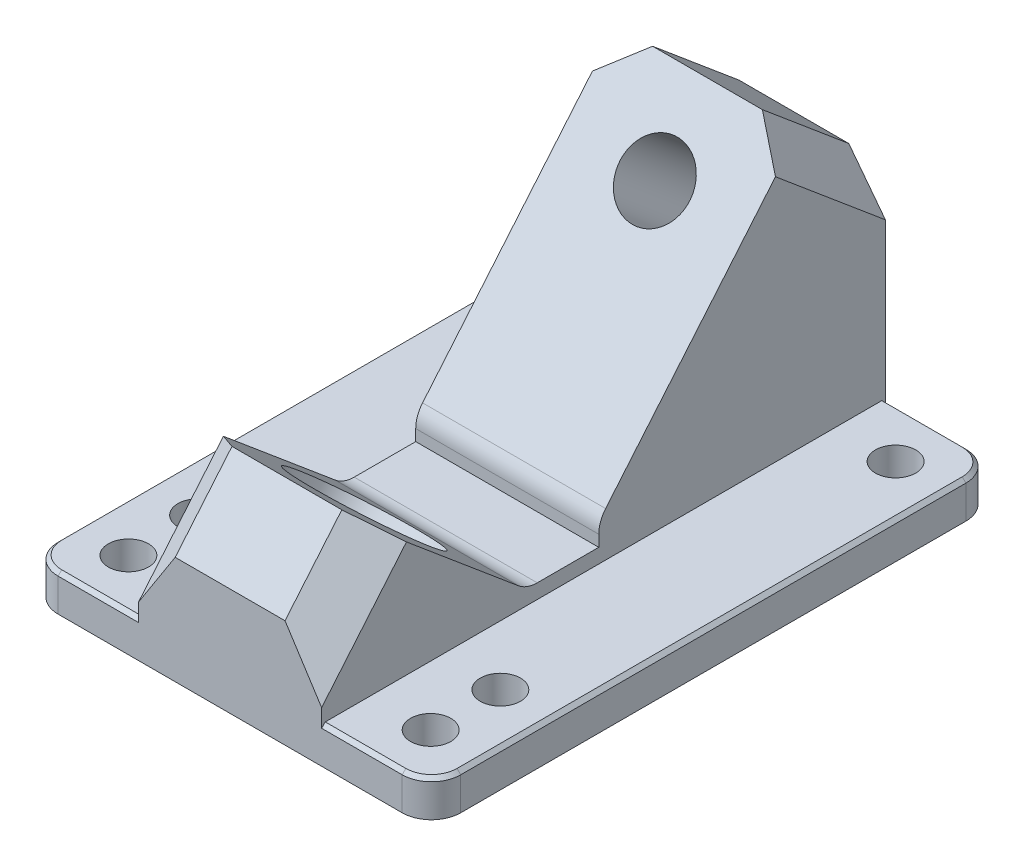
from build123d import *
from OCP.BRepFilletAPI import BRepFilletAPI_MakeChamfer

# Parameters (mm, degrees)
SKETCH1_W                  = 55
SKETCH1_H                  = 77
BOSS_EXTRUDE1_DEPTH        = 45
CUT_EXTRUDE1_DEPTH         = 66.295482233
CUT_EXTRUDE1_DEPTH_BACK    = 66.295482233
SKETCH2_W                  = 15
SKETCH2_H                  = 45
CUT_EXTRUDE2_DEPTH         = 61.526853545
CUT_EXTRUDE2_DEPTH_BACK    = 61.526853545
SKETCH9_R                  = 4.7625
CUT_EXTRUDE5_DEPTH         = 60.605373357
CUT_EXTRUDE4_DEPTH         = 7.5
CUT_EXTRUDE4_DEPTH_BACK    = 7.5
CHAMFER1_SIZE              = 5
FILLET1_R                  = 4
F_12_0MM_DOWEL_HOLE2_D     = 18
F_12_0MM_DOWEL_HOLE2_DEPTH = 12
F_12_0MM_DOWEL_HOLE2_TIP   = 5.407745571
CUT_EXTRUDE6_DEPTH         = 59.947948642
CUT_EXTRUDE6_DEPTH_BACK    = 59.947948642
SKETCH16_W                 = 77
SKETCH16_H                 = 0.28
SKETCH17_W                 = 15
SKETCH17_H                 = 77
BOSS_EXTRUDE2_DEPTH        = 5
SKETCH18_R                 = 2.75
CUT_EXTRUDE8_DEPTH         = 10
FILLET2_R                  = 4
CHAMFER2_SIZE              = 0.5
CHAMFER2_SIZE2             = 4.056570221


with BuildPart() as part:
    # Sketch1 → Boss-Extrude1 (new body)
    with BuildSketch(Plane(origin=(0, 0, 0), x_dir=(1, 0, 0), z_dir=(0, 1, 0))):
        Rectangle(SKETCH1_W, SKETCH1_H)
    extrude(amount=BOSS_EXTRUDE1_DEPTH)

    # Sketch2 → Cut-Extrude1 (cut, two sides: drawn at the far end of the back side and taken through both)
    with BuildSketch(Plane.XY.offset(-CUT_EXTRUDE1_DEPTH_BACK)):
        with Locations((-20, 22.5)):
            Rectangle(SKETCH2_W, SKETCH2_H)
        with Locations((20, 22.5)):
            Rectangle(SKETCH2_W, SKETCH2_H)
    extrude(amount=CUT_EXTRUDE1_DEPTH + CUT_EXTRUDE1_DEPTH_BACK, mode=Mode.SUBTRACT)

    # Sketch3 → Cut-Extrude2 (cut, two sides: drawn at the far end of the back side and taken through both)
    with BuildSketch(Plane(origin=(0, 0, 0), x_dir=(0, 0, -1), z_dir=(1, 0, 0)).offset(-CUT_EXTRUDE2_DEPTH_BACK)):
        Polygon((-38.5, 15), (-31.51055999, 23.329690242), (-30.745642734, 24.241283129), (-10.508137558, 7.26), (-0.650260841, 7.26), (-0.650260841, 10.26), (26.698327812, 42.85277878), (38.5, 32.95), (38.5, 45), (24.14, 45), (-38.5, 45), align=None)
    extrude(amount=CUT_EXTRUDE2_DEPTH + CUT_EXTRUDE2_DEPTH_BACK, mode=Mode.SUBTRACT)

    # Sketch9 → Cut-Extrude5 (cut, through all)
    with BuildSketch(Plane(origin=(0, 4.559375807, 5.433652498), x_dir=(1, 0, 0), z_dir=(0, 0.6427876096865435, 0.7660444431189747))):
        with Locations(Location((0, 38.806982034, 0), (0, 0, 270))):
            Circle(SKETCH9_R)
    extrude(amount=-CUT_EXTRUDE5_DEPTH, mode=Mode.SUBTRACT)

    # Sketch5 → Cut-Extrude4 (cut, two sides: drawn at the far end of the back side and taken through both)
    with BuildSketch(Plane(origin=(0, 0, 0), x_dir=(0, 0, -1), z_dir=(1, 0, 0)).offset(-CUT_EXTRUDE4_DEPTH_BACK)):
        Polygon((38.5, 0), (38.5, 30), (13.327011065, 0), align=None)
    extrude(amount=CUT_EXTRUDE4_DEPTH + CUT_EXTRUDE4_DEPTH_BACK, mode=Mode.SUBTRACT)

    # Chamfer1
    chamfer1_edges = [part.edges().sort_by_distance(p)[0] for p in [
        (-12.5, 19.620641565, 34.622821367),
        (-12.5, 37.90138939, -32.599163906),
        (12.5, 19.620641565, 34.622821367),
        (12.5, 37.90138939, -32.599163906),
    ]]
    chamfer(chamfer1_edges, length=CHAMFER1_SIZE)

    # Fillet1
    fillet1_edges = [part.edges().sort_by_distance(p)[0] for p in [
        (0, 10.26, 0.650260841),
        (0, 7.26, 10.508137558),
    ]]
    fillet(fillet1_edges, radius=FILLET1_R)

    # Ø12.0mm Dowel Hole2
    with Locations(Plane(origin=(0, -0.913904784, 0.766857167), x_dir=(1, 0, 0), z_dir=(0, 0.7660444431189749, -0.6427876096865432))):
        with Locations((0, -25.333129579)):
            Hole(F_12_0MM_DOWEL_HOLE2_D / 2, depth=F_12_0MM_DOWEL_HOLE2_DEPTH)
            with Locations((0, 0, -(F_12_0MM_DOWEL_HOLE2_DEPTH + F_12_0MM_DOWEL_HOLE2_TIP / 2))):  # 118° drill point
                Cone(0, F_12_0MM_DOWEL_HOLE2_D / 2, F_12_0MM_DOWEL_HOLE2_TIP, mode=Mode.SUBTRACT)

    # Sketch16 → Cut-Extrude6 (cut, two sides: drawn at the far end of the back side and taken through both)
    with BuildSketch(Plane(origin=(0, 0, 0), x_dir=(0, 0, -1), z_dir=(1, 0, 0)).offset(-CUT_EXTRUDE6_DEPTH_BACK)):
        with Locations((0, 0.14)):
            Rectangle(SKETCH16_W, SKETCH16_H)
    extrude(amount=CUT_EXTRUDE6_DEPTH + CUT_EXTRUDE6_DEPTH_BACK, mode=Mode.SUBTRACT)

    # Sketch17 → Boss-Extrude2 (add)
    with BuildSketch(Plane.XZ.offset(-0.28)):
        with Locations((-20, 0)):
            Rectangle(SKETCH17_W, SKETCH17_H)
        with Locations((20, 0)):
            Rectangle(SKETCH17_W, SKETCH17_H)
    extrude(amount=-BOSS_EXTRUDE2_DEPTH)

    # Sketch18 → Cut-Extrude8 (cut)
    with BuildSketch(Plane(origin=(0, 0, 0), x_dir=(1, 0, 0), z_dir=(0, 1, 0))):
        with Locations(Location((-20.64, -31.75, 0), (0, 0, 270))):
            Circle(SKETCH18_R)
        with Locations(Location((-20.64, 31.75, 0), (0, 0, 270))):
            Circle(SKETCH18_R)
        with Locations(Location((-20.64, -22.23, 0), (0, 0, 270))):
            Circle(SKETCH18_R)
        with Locations(Location((20.64, -22.23, 0), (0, 0, 270))):
            Circle(SKETCH18_R)
        with Locations(Location((20.64, 31.75, 0), (0, 0, 270))):
            Circle(SKETCH18_R)
        with Locations(Location((20.64, -31.75, 0), (0, 0, 270))):
            Circle(SKETCH18_R)
    extrude(amount=CUT_EXTRUDE8_DEPTH, mode=Mode.SUBTRACT)

    # Fillet2
    fillet2_edges = [part.edges().sort_by_distance(p)[0] for p in [
        (27.5, 2.78, -38.5),
        (27.5, 2.78, 38.5),
        (-27.5, 2.78, -38.5),
        (-27.5, 2.78, 38.5),
    ]]
    fillet(fillet2_edges, radius=FILLET2_R)

    # Chamfer2: one chamfer whose edges measure the first distance from different faces: ONE call of the kernel's chamfer builder (chamfer() names one face for all edges)
    chamfer2_edges_1 = [part.edges().sort_by_distance(p)[0] for p in [
        (-7.5, 15.14, -38.5),
        (-7.5, 0.28, -26.030979481),
        (7.5, 0.28, -26.030979481),
        (7.5, 15.14, -38.5),
        (-18, 5.28, -38.5),
        (-26.328427125, 5.28, -37.328427125),
        (-27.5, 5.28, 0),
        (-26.328427125, 5.28, 37.328427125),
        (-18, 5.28, 38.5),
        (18, 5.28, -38.5),
        (26.328427125, 5.28, -37.328427125),
        (27.5, 5.28, 0),
        (26.328427125, 5.28, 37.328427125),
        (18, 5.28, 38.5),
    ]]
    chamfer2_edges_2 = [part.edges().sort_by_distance(p)[0] for p in [
        (0, 0.28, -13.561958961),
    ]]
    chamfer2_side_2 = [part.faces().sort_by_distance(p)[0] for p in [
        (0, 14.020211625, -25.091365468),
    ]]
    chamfer2 = BRepFilletAPI_MakeChamfer(part.part.solid().wrapped)
    for e in chamfer2_edges_1:
        chamfer2.Add(CHAMFER2_SIZE, e.wrapped)
    for e in chamfer2_edges_2:
        chamfer2.Add(CHAMFER2_SIZE, CHAMFER2_SIZE2, e.wrapped, chamfer2_side_2[0].wrapped)  # the first distance lies on this face
    add(Compound.cast(chamfer2.Shape()), mode=Mode.REPLACE)


solid = part.part
